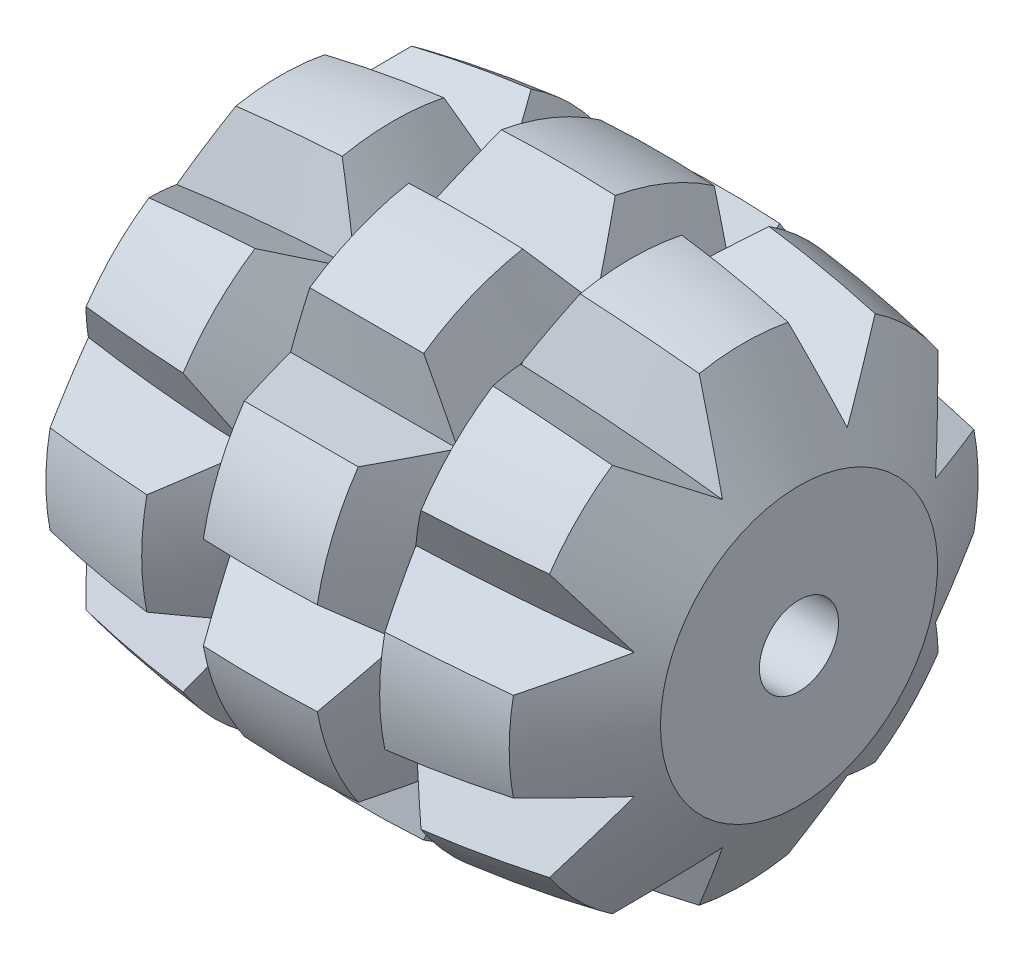
from build123d import *

# Parameters (mm, degrees)
CUT_REVOLVE_1_ANGLE      = 8.5
PATTERN_CIRCULAR_1_COUNT = 8
CUT_REVOLVE_2_ANGLE      = 11
PATTERN_CIRCULAR_2_COUNT = 8
MIRROR_1_COPY_1_ANGLE    = 11
MIRROR_1_COPY_2_ANGLE    = 11
MIRROR_1_COPY_3_ANGLE    = 11
MIRROR_1_COPY_4_ANGLE    = 11
MIRROR_1_COPY_5_ANGLE    = 11
MIRROR_1_COPY_6_ANGLE    = 11
MIRROR_1_COPY_7_ANGLE    = 11


with BuildPart() as part:
    # 草图1 → 旋转1 (revolve)
    with BuildSketch(Plane.XY, mode=Mode.PRIVATE) as revolve_1_sk:
        with BuildLine():
            Line((-14.5, 54), (-11.705419321, 58.847116824))
            ThreePointArc((-11.705419321, 58.847116824), (-8.868564668, 59.340951802), (-6.011283697, 59.698111095))
            Line((-6.011283697, 59.698111095), (-4.224183941, 56.843260551))
            Line((-4.224183941, 56.843260551), (-2.878687711, 59.930903189))
            ThreePointArc((-2.878687711, 59.930903189), (0, 60), (2.878687711, 59.930903189))
            Line((2.878687711, 59.930903189), (4.224183941, 56.843260551))
            Line((4.224183941, 56.843260551), (6.011283697, 59.698111095))
            ThreePointArc((6.011283697, 59.698111095), (8.868564668, 59.340951802), (11.705419321, 58.847116824))
            Line((11.705419321, 58.847116824), (14.5, 54))
            Line((14.5, 54), (14.5, 49))
            Line((14.5, 49), (-14.5, 49))
            Line((-14.5, 49), (-14.5, 54))
        make_face()
    revolve(revolve_1_sk.sketch.rotate(Axis((-35.051334165, 47, 0), (1, 0, 0)), 90), axis=Axis((-35.051334165, 47, 0), (1, 0, 0)))

    # 草图2 → 切除-旋转1 (revolve, symmetric, cut)
    with BuildSketch(Plane.ZY) as cut_revolve_1_sk:
        Polygon((0, 57), (3.600537716, 61.290953758), (-3.600537716, 61.290953758), align=None)
    cut_revolve_1 = revolve(axis=Axis((0, 0, 0), (0, 0, 1)), revolution_arc=CUT_REVOLVE_1_ANGLE / 2, mode=Mode.SUBTRACT)
    cut_revolve_1 = cut_revolve_1 + revolve(cut_revolve_1_sk.sketch, axis=Axis((0, 0, 0), (0, 0, -1)), revolution_arc=CUT_REVOLVE_1_ANGLE / 2, mode=Mode.SUBTRACT)

    # 阵列(圆周)1: 切除-旋转1 ×8 about axis
    pattern_circular_1_axis = Axis((-43.099183559, 47, 0), (1, 0, 0))
    for i in range(1, PATTERN_CIRCULAR_1_COUNT):
        add(cut_revolve_1.rotate(pattern_circular_1_axis, i * 360 / PATTERN_CIRCULAR_1_COUNT), mode=Mode.SUBTRACT)

    # 草图7 → 切除-旋转2 (revolve, cut)
    with BuildSketch(Plane(origin=(-0.269512634, -0.018503689, -0.007664479), x_dir=(-0.028293486834179028, -0.0019425207123432708, 0.9995977717142263), z_dir=(-0.9972501850994857, -0.06846731727684285, -0.028360091395370088))):
        Polygon((3.749583196, 56.187896189), (9.657128825, 59.270476178), (1.739669056, 62.540977323), align=None)
    cut_revolve_2 = revolve(axis=Axis((0, 3.513824843, -18.012563526), (0, -0.3826834323650904, 0.9238795325112865)), revolution_arc=CUT_REVOLVE_2_ANGLE, mode=Mode.SUBTRACT)

    # 阵列(圆周)2: 切除-旋转2 ×8 about axis
    pattern_circular_2_axis = Axis((0, 47, 0), (1, 0, 0))
    for i in range(1, PATTERN_CIRCULAR_2_COUNT):
        add(cut_revolve_2.rotate(pattern_circular_2_axis, i * 360 / PATTERN_CIRCULAR_2_COUNT), mode=Mode.SUBTRACT)

    # 镜向1: 切除-旋转2 across plane
    add(cut_revolve_2.mirror(Plane.ZY), mode=Mode.SUBTRACT)

    # 镜向1 copy 1 sketch → 镜向1 copy 1 (revolve, cut)
    with BuildSketch(Plane(origin=(0.269512634, 13.758316805, -33.252522405), x_dir=(0.028293486834179028, -0.7081959324063851, 0.7054487932697987), z_dir=(0.9972501850994857, -0.028360091395370005, -0.0684673172768429))):
        Polygon((3.749583196, -56.187896189), (9.657128825, -59.270476178), (1.739669056, -62.540977323), align=None)
    revolve(axis=Axis((0, 28.987436474, -43.486175157), (0, 0.923879532511287, -0.3826834323650893)), revolution_arc=MIRROR_1_COPY_1_ANGLE, mode=Mode.SUBTRACT)

    # 镜向1 copy 2 sketch → 镜向1 copy 2 (revolve, cut)
    with BuildSketch(Plane(origin=(0.269512634, 47.007664479, -47.018503689), x_dir=(0.028293486834179028, -0.9995977717142263, -0.0019425207123432097), z_dir=(0.9972501850994857, 0.028360091395370084, -0.06846731727684285))):
        Polygon((3.749583196, -56.187896189), (9.657128825, -59.270476178), (1.739669056, -62.540977323), align=None)
    revolve(axis=Axis((0, 65.012563526, -43.486175157), (0, 0.9238795325112865, 0.38268343236509034)), revolution_arc=MIRROR_1_COPY_2_ANGLE, mode=Mode.SUBTRACT)

    # 镜向1 copy 3 sketch → 镜向1 copy 3 (revolve, cut)
    with BuildSketch(Plane(origin=(0.269512634, 80.252522405, -33.241683195), x_dir=(0.028293486834179028, -0.7054487932697987, -0.7081959324063851), z_dir=(0.9972501850994857, 0.0684673172768429, -0.028360091395370005))):
        Polygon((3.749583196, -56.187896189), (9.657128825, -59.270476178), (1.739669056, -62.540977323), align=None)
    revolve(axis=Axis((0, 90.486175157, -18.012563526), (0, 0.3826834323650893, 0.923879532511287)), revolution_arc=MIRROR_1_COPY_3_ANGLE, mode=Mode.SUBTRACT)

    # 镜向1 copy 4 sketch → 镜向1 copy 4 (revolve, cut)
    with BuildSketch(Plane(origin=(0.269512634, 94.018503689, 0.007664479), x_dir=(0.028293486834179028, 0.0019425207123431483, -0.9995977717142263), z_dir=(0.9972501850994857, 0.06846731727684285, 0.02836009139537008))):
        Polygon((3.749583196, -56.187896189), (9.657128825, -59.270476178), (1.739669056, -62.540977323), align=None)
    revolve(axis=Axis((0, 90.486175157, 18.012563526), (0, -0.3826834323650903, 0.9238795325112865)), revolution_arc=MIRROR_1_COPY_4_ANGLE, mode=Mode.SUBTRACT)

    # 镜向1 copy 5 sketch → 镜向1 copy 5 (revolve, cut)
    with BuildSketch(Plane(origin=(0.269512634, 80.241683195, 33.252522405), x_dir=(0.028293486834179028, 0.7081959324063851, -0.7054487932697988), z_dir=(0.9972501850994857, 0.02836009139537001, 0.0684673172768429))):
        Polygon((3.749583196, -56.187896189), (9.657128825, -59.270476178), (1.739669056, -62.540977323), align=None)
    revolve(axis=Axis((0, 65.012563526, 43.486175157), (0, -0.9238795325112871, 0.3826834323650894)), revolution_arc=MIRROR_1_COPY_5_ANGLE, mode=Mode.SUBTRACT)

    # 镜向1 copy 6 sketch → 镜向1 copy 6 (revolve, cut)
    with BuildSketch(Plane(origin=(0.269512634, 46.992335521, 47.018503689), x_dir=(0.028293486834179028, 0.9995977717142263, 0.0019425207123430872), z_dir=(0.9972501850994857, -0.028360091395370074, 0.06846731727684285))):
        Polygon((3.749583196, -56.187896189), (9.657128825, -59.270476178), (1.739669056, -62.540977323), align=None)
    revolve(axis=Axis((0, 28.987436474, 43.486175157), (0, -0.9238795325112866, -0.3826834323650902)), revolution_arc=MIRROR_1_COPY_6_ANGLE, mode=Mode.SUBTRACT)

    # 镜向1 copy 7 sketch → 镜向1 copy 7 (revolve, cut)
    with BuildSketch(Plane(origin=(0.269512634, 13.747477595, 33.241683195), x_dir=(0.028293486834179028, 0.7054487932697988, 0.708195932406385), z_dir=(0.9972501850994857, -0.06846731727684288, 0.028360091395370015))):
        Polygon((3.749583196, -56.187896189), (9.657128825, -59.270476178), (1.739669056, -62.540977323), align=None)
    revolve(axis=Axis((0, 3.513824843, 18.012563526), (0, -0.38268343236508945, -0.923879532511287)), revolution_arc=MIRROR_1_COPY_7_ANGLE, mode=Mode.SUBTRACT)


solid = part.part
